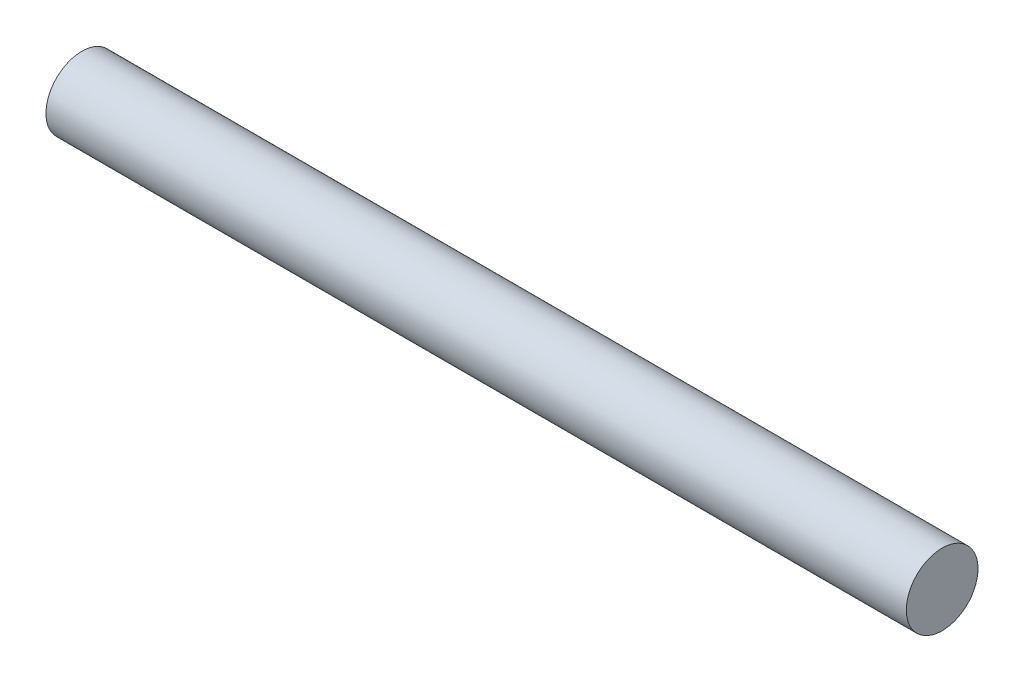
from build123d import *

# Parameters (mm, degrees)
SKETCH1_R           = 25
BOSS_EXTRUDE1_DEPTH = 300


with BuildPart() as part:
    # Sketch1 → Boss-Extrude1 (new, symmetric)
    with BuildSketch(Plane(origin=(0, 0, 0), x_dir=(0, 0, -1), z_dir=(1, 0, 0))):
        Circle(SKETCH1_R)
    extrude(amount=BOSS_EXTRUDE1_DEPTH, both=True)


solid = part.part
